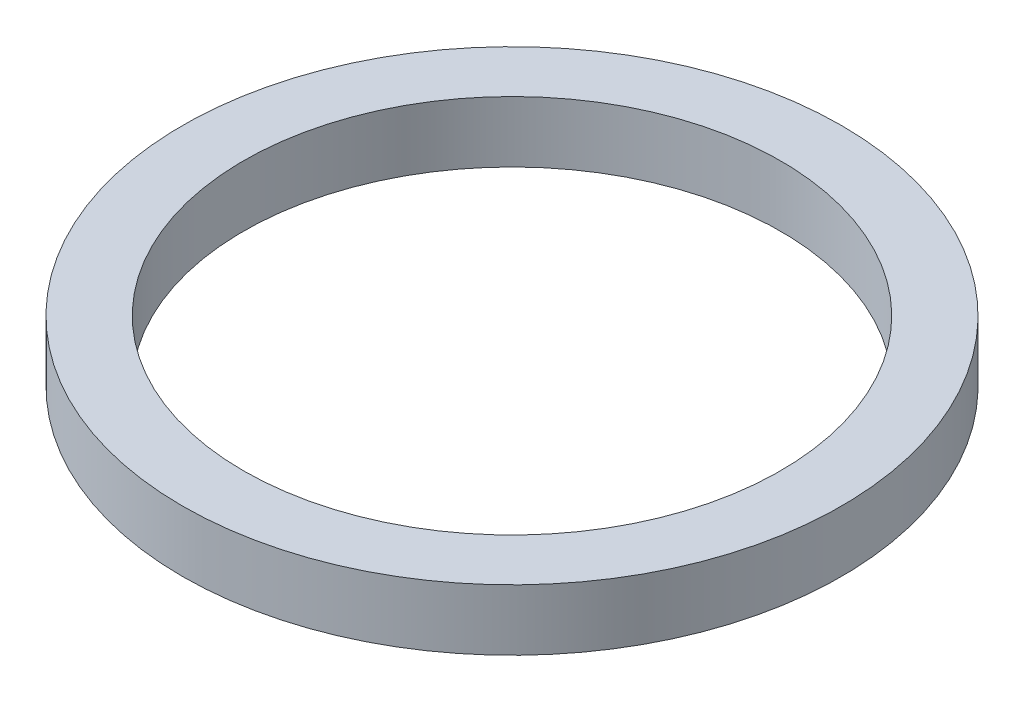
from build123d import *

# Parameters (mm, degrees)
SKETCH_1_R      = 22
EXTRUDE_1_DEPTH = 2.5


with BuildPart() as part:
    # 草圖1 → 填料-伸長1 (new, symmetric)
    with BuildSketch(Plane(origin=(0, 0, 0), x_dir=(1, 0, 0), z_dir=(0, 1, 0))):
        with BuildLine():
            ThreePointArc((0.892561983, 26.985242877), (-27, 0), (0.892561983, -26.985242877))
            ThreePointArc((0.892561983, -26.985242877), (27, 0), (0.892561983, 26.985242877))
        make_face()
        with Locations(Location((0, 0, 0), (0, 0, 270))):
            Circle(SKETCH_1_R, mode=Mode.SUBTRACT)
    extrude(amount=EXTRUDE_1_DEPTH, both=True)


solid = part.part
